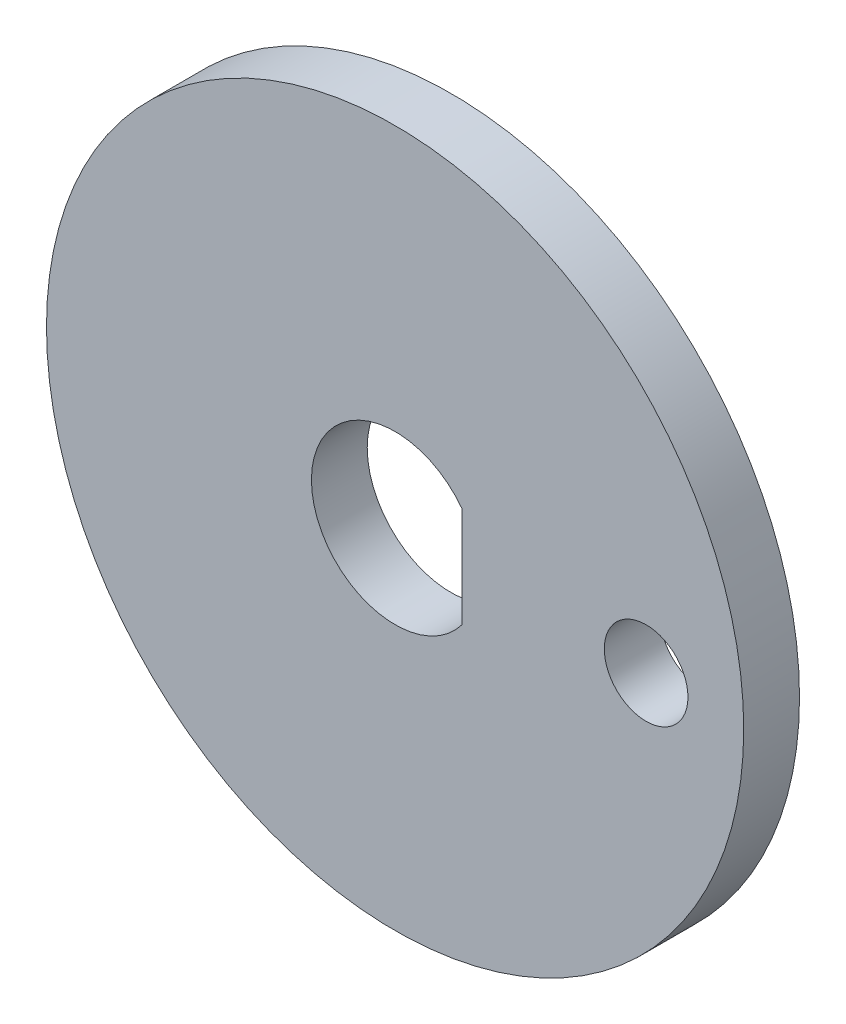
from build123d import *

# Parameters (mm, degrees)
SKETCH1_R           = 12.5
SKETCH1_R_2         = 1.5
BOSS_EXTRUDE1_DEPTH = 2


with BuildPart() as part:
    # Sketch1 → Boss-Extrude1 (new body)
    with BuildSketch(Plane.XY):
        with Locations((6.9, 0)):
            Circle(SKETCH1_R)
        with Locations((15.9, 0)):
            Circle(SKETCH1_R_2, mode=Mode.SUBTRACT)
        with BuildLine():
            Line((9.3, -1.8), (9.3, 1.8))
            ThreePointArc((9.3, 1.8), (3.9, 0), (9.3, -1.8))
        make_face(mode=Mode.SUBTRACT)
    extrude(amount=BOSS_EXTRUDE1_DEPTH)


solid = part.part
